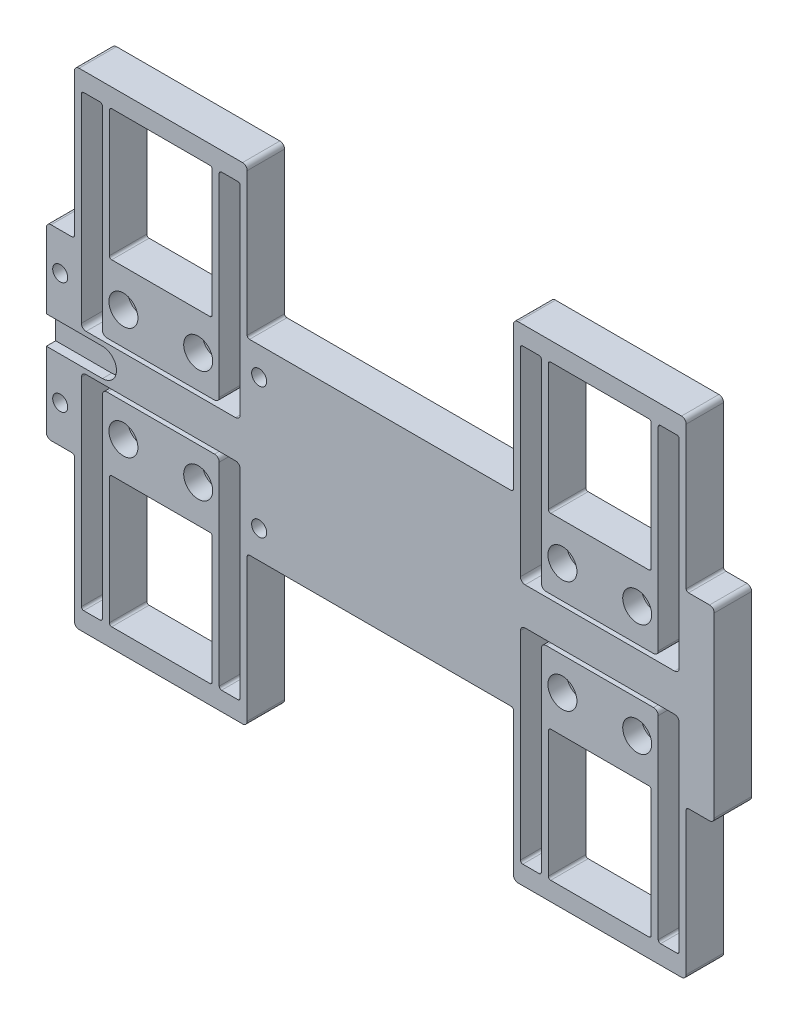
from build123d import *

# Parameters (mm, degrees)
SKETCH6_W                               = 34.925
SKETCH6_H                               = 44.45
EXTRUDE1_DEPTH                          = 6.35
CROSS_FEED_1_4_COUNTERBORES_D           = 6.7564
CROSS_FEED_1_4_COUNTERBORES_CBORE_D     = 9.8425
CROSS_FEED_1_4_COUNTERBORES_CBORE_DEPTH = 6.35
F_1_4_SCREW_MOUNTING_HOLES_D            = 5.1054
FLEXURE_FILLETS_R                       = 0.79375
SAFETY_RADIUS_R                         = 1.5875
EXTRUDE2_DEPTH                          = 3.175


with BuildPart() as part:
    # Sketch6 → Extrude1 (new, symmetric)
    with BuildSketch(Plane(origin=(0, 12.7, 0), x_dir=(-1, 0, 0), z_dir=(0, 0, -1))):
        Polygon((-45.212, -44.45), (45.212, -44.45), (45.212, -95.25), (103.886, -95.25), (103.886, -44.45), (113.411, -44.45), (113.411, 19.05), (103.886, 19.05), (103.886, 69.85), (45.212, 69.85), (45.212, 19.05), (-45.212, 19.05), (-45.212, 69.85), (-103.886, 69.85), (-103.886, 19.05), (-113.411, 19.05), (-113.411, -44.45), (-103.886, -44.45), (-103.886, -95.25), (-45.212, -95.25), align=None)
        Polygon((-94.39275, -88.9), (-94.39275, -20.6375), (-54.70525, -20.6375), (-54.70525, -88.9), (-47.59325, -88.9), (-47.59325, -19.05), (-101.50475, -19.05), (-101.50475, -88.9), align=None, mode=Mode.SUBTRACT)
        Polygon((-101.50475, -6.35), (-47.59325, -6.35), (-47.59325, 63.5), (-54.70525, 63.5), (-54.70525, -4.7625), (-94.39275, -4.7625), (-94.39275, 63.5), (-101.50475, 63.5), align=None, mode=Mode.SUBTRACT)
        with Locations((-74.549, 41.275)):
            Rectangle(SKETCH6_W, SKETCH6_H, mode=Mode.SUBTRACT)
        Polygon((101.50475, -19.05), (47.59325, -19.05), (47.59325, -88.9), (54.70525, -88.9), (54.70525, -20.6375), (94.39275, -20.6375), (94.39275, -88.9), (101.50475, -88.9), align=None, mode=Mode.SUBTRACT)
        with Locations((74.549, -66.675)):
            Rectangle(SKETCH6_W, SKETCH6_H, mode=Mode.SUBTRACT)
        Polygon((94.39275, 63.5), (94.39275, -4.7625), (54.70525, -4.7625), (54.70525, 63.5), (47.59325, 63.5), (47.59325, -6.35), (101.50475, -6.35), (101.50475, 63.5), align=None, mode=Mode.SUBTRACT)
        with Locations((-74.549, -66.675)):
            Rectangle(SKETCH6_W, SKETCH6_H, mode=Mode.SUBTRACT)
        with Locations((74.549, 41.275)):
            Rectangle(SKETCH6_W, SKETCH6_H, mode=Mode.SUBTRACT)
    extrude(amount=EXTRUDE1_DEPTH, both=True)

    # Cross feed 1/4 counterbores (through all)
    with Locations(Plane.XY.offset(6.35)):
        with Locations((61.849, 19.05), (87.249, 19.05), (87.249, -19.05), (61.849, -19.05), (-61.849, -19.05), (-87.249, -19.05), (-87.249, 19.05), (-61.849, 19.05)):
            CounterBoreHole(CROSS_FEED_1_4_COUNTERBORES_D / 2, CROSS_FEED_1_4_COUNTERBORES_CBORE_D / 2, CROSS_FEED_1_4_COUNTERBORES_CBORE_DEPTH)

    # 1/4 screw mounting holes (through all)
    with Locations(Plane.XY.offset(6.35)):
        with Locations((-108.712, 19.05), (-41.148, 22.225), (-41.148, -22.225), (-108.712, -19.05)):
            Hole(F_1_4_SCREW_MOUNTING_HOLES_D / 2)

    # Flexure fillets
    flexure_fillets_edges = [part.edges().sort_by_distance(p)[0] for p in [
        (54.70525, -76.2, 0),
        (47.59325, -76.2, 0),
        (101.50475, -76.2, 0),
        (94.39275, -76.2, 0),
        (57.0865, -31.75, 0),
        (92.0115, -31.75, 0),
        (92.0115, -76.2, 0),
        (57.0865, -76.2, 0),
        (-101.50475, -76.2, 0),
        (-47.59325, -76.2, 0),
        (-54.70525, -76.2, 0),
        (-94.39275, -76.2, 0),
        (-92.0115, -76.2, 0),
        (-92.0115, -31.75, 0),
        (-57.0865, -31.75, 0),
        (-57.0865, -76.2, 0),
        (-57.0865, 31.75, 0),
        (-92.0115, 31.75, 0),
        (-92.0115, 76.2, 0),
        (-57.0865, 76.2, 0),
        (45.212, 31.75, 0),
        (-45.212, 31.75, 0),
        (-103.886, 31.75, 0),
        (-103.886, -31.75, 0),
        (-45.212, -31.75, 0),
        (45.212, -31.75, 0),
        (103.886, -31.75, 0),
        (103.886, 31.75, 0),
        (101.50475, 76.2, 0),
        (47.59325, 76.2, 0),
        (54.70525, 76.2, 0),
        (94.39275, 76.2, 0),
        (92.0115, 76.2, 0),
        (92.0115, 31.75, 0),
        (57.0865, 31.75, 0),
        (57.0865, 76.2, 0),
        (-101.50475, 76.2, 0),
        (-94.39275, 76.2, 0),
        (-54.70525, 76.2, 0),
        (-47.59325, 76.2, 0),
    ]]
    fillet(flexure_fillets_edges, radius=FLEXURE_FILLETS_R)

    # Safety radius
    safety_radius_edges = [part.edges().sort_by_distance(p)[0] for p in [
        (47.59325, -6.35, 0),
        (101.50475, -6.35, 0),
        (94.39275, -7.9375, 0),
        (54.70525, -7.9375, 0),
        (-101.50475, -6.35, 0),
        (-47.59325, -6.35, 0),
        (-54.70525, -7.9375, 0),
        (-94.39275, -7.9375, 0),
        (45.212, 82.55, 0),
        (-45.212, 82.55, 0),
        (-103.886, 82.55, 0),
        (-113.411, 31.75, 0),
        (-113.411, -31.75, 0),
        (-103.886, -82.55, 0),
        (-45.212, -82.55, 0),
        (45.212, -82.55, 0),
        (103.886, -82.55, 0),
        (113.411, -31.75, 0),
        (113.411, 31.75, 0),
        (103.886, 82.55, 0),
        (101.50475, 6.35, 0),
        (47.59325, 6.35, 0),
        (54.70525, 7.9375, 0),
        (94.39275, 7.9375, 0),
        (-94.39275, 7.9375, 0),
        (-54.70525, 7.9375, 0),
        (-47.59325, 6.35, 0),
        (-101.50475, 6.35, 0),
    ]]
    fillet(safety_radius_edges, radius=SAFETY_RADIUS_R)

    # Sketch11 → Extrude2 (cut)
    with BuildSketch(Plane(origin=(0, 0, 6.35), x_dir=(-1, 0, 0), z_dir=(0, 0, -1))):
        with BuildLine():
            Line((113.411, -4.7625), (94.361, -4.7625))
            ThreePointArc((94.361, -4.7625), (89.5985, 0), (94.361, 4.7625))
            Line((94.361, 4.7625), (113.411, 4.7625))
            Line((113.411, 4.7625), (113.411, -4.7625))
        make_face()
    extrude(amount=EXTRUDE2_DEPTH, mode=Mode.SUBTRACT)


solid = part.part
